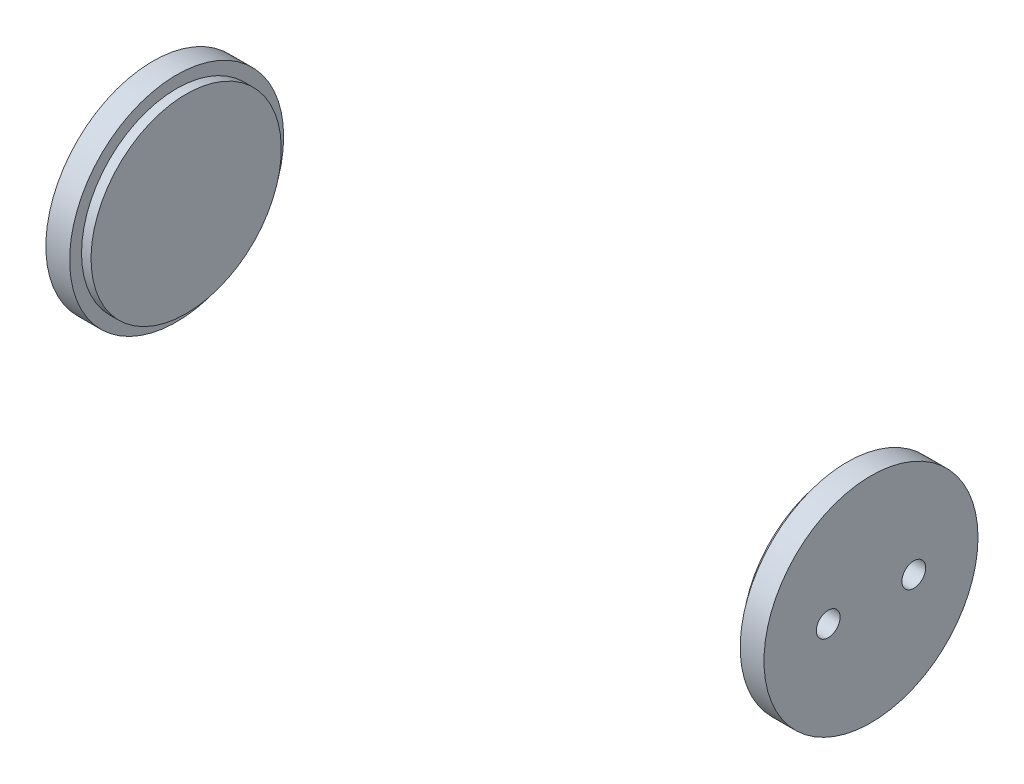
from build123d import *

# Parameters (mm, degrees)
SKETCH1_R           = 22.5
BOSS_EXTRUDE1_DEPTH = 2.5
SKETCH2_R           = 20
BOSS_EXTRUDE2_DEPTH = 2
BOSS_EXTRUDE3_START = 66
SKETCH3_R           = 22.5
BOSS_EXTRUDE3_DEPTH = 66
SKETCH4_R           = 12.5
BOSS_EXTRUDE4_DEPTH = 5
BOSS_EXTRUDE5_START = 66
SKETCH5_R           = 22.5
BOSS_EXTRUDE5_DEPTH = 66
SKETCH6_R           = 20
BOSS_EXTRUDE6_DEPTH = 2
BOSS_EXTRUDE7_START = 5
SKETCH7_R           = 22.5
BOSS_EXTRUDE7_DEPTH = 5
SKETCH8_R           = 2.5
CUT_EXTRUDE1_DEPTH  = 5
CUT_EXTRUDE2_START  = -5
SKETCH9_R           = 2.5
CUT_EXTRUDE2_DEPTH  = 5
SKETCH10_W          = 137
SKETCH10_H          = 45
CUT_EXTRUDE4_DEPTH  = 32


with BuildPart() as part:
    # Sketch1 → Boss-Extrude1 (new, symmetric)
    with BuildSketch(Plane(origin=(0, 0, 0), x_dir=(0, 0, -1), z_dir=(1, 0, 0))):
        Circle(SKETCH1_R)
    extrude(amount=BOSS_EXTRUDE1_DEPTH, both=True)

    # Sketch2 → Boss-Extrude2 (add)
    with BuildSketch(Plane(origin=(2.5, 0, 0), x_dir=(0, 0, -1), z_dir=(1, 0, 0))):
        Circle(SKETCH2_R)
    extrude(amount=BOSS_EXTRUDE2_DEPTH)

    # Sketch3 → Boss-Extrude3 (add)
    with BuildSketch(Plane(origin=(4.5, 0, 0), x_dir=(0, 0, -1), z_dir=(1, 0, 0)).offset(BOSS_EXTRUDE3_START)):
        Circle(SKETCH3_R)
    extrude(amount=-BOSS_EXTRUDE3_DEPTH)

    # Sketch4 → Boss-Extrude4 (add)
    with BuildSketch(Plane(origin=(70.5, 0, 0), x_dir=(0, 0, -1), z_dir=(1, 0, 0))):
        Circle(SKETCH4_R)
    extrude(amount=BOSS_EXTRUDE4_DEPTH)

    # Sketch5 → Boss-Extrude5 (add)
    with BuildSketch(Plane(origin=(75.5, 0, 0), x_dir=(0, 0, -1), z_dir=(1, 0, 0)).offset(BOSS_EXTRUDE5_START)):
        Circle(SKETCH5_R)
    extrude(amount=-BOSS_EXTRUDE5_DEPTH)

    # Sketch6 → Boss-Extrude6 (add)
    with BuildSketch(Plane(origin=(141.5, 0, 0), x_dir=(0, 0, -1), z_dir=(1, 0, 0))):
        Circle(SKETCH6_R)
    extrude(amount=BOSS_EXTRUDE6_DEPTH)

    # Sketch7 → Boss-Extrude7 (add)
    with BuildSketch(Plane(origin=(143.5, 0, 0), x_dir=(0, 0, -1), z_dir=(1, 0, 0)).offset(BOSS_EXTRUDE7_START)):
        Circle(SKETCH7_R)
    extrude(amount=-BOSS_EXTRUDE7_DEPTH)

    # Sketch8 → Cut-Extrude1 (cut)
    with BuildSketch(Plane(origin=(148.5, 0, 0), x_dir=(0, 0, -1), z_dir=(1, 0, 0))):
        with Locations((-9, 0)):
            Circle(SKETCH8_R)
        with Locations((9, 0)):
            Circle(SKETCH8_R)
    extrude(amount=-CUT_EXTRUDE1_DEPTH, mode=Mode.SUBTRACT)

    # Sketch9 → Cut-Extrude2 (cut)
    with BuildSketch(Plane.ZY.offset(2.5).offset(CUT_EXTRUDE2_START)):
        with Locations(Location((-9, 0, 0), (0, 0, 180))):
            Circle(SKETCH9_R)
        with Locations(Location((9, 0, 0), (0, 0, 180))):
            Circle(SKETCH9_R)
    extrude(amount=CUT_EXTRUDE2_DEPTH, mode=Mode.SUBTRACT)

    # Sketch10 → Cut-Extrude4 (cut, symmetric)
    with BuildSketch(Plane.XY):
        with Locations((73, 0)):
            Rectangle(SKETCH10_W, SKETCH10_H)
    extrude(amount=CUT_EXTRUDE4_DEPTH, both=True, mode=Mode.SUBTRACT)


with BuildPart() as cut_extrude4_piece_1:
    # of the separate pieces the step leaves, piece 1, a body of its own (cut_extrude4_pieces)
    add(part.part.solids().sort_by_distance((2.5, 0, -20))[0])


with BuildPart() as cut_extrude4_piece_2:
    # of the separate pieces the step leaves, piece 2, a body of its own (cut_extrude4_pieces)
    add(part.part.solids().sort_by_distance((148.5, 0, -22.5))[0])


solid = Compound([cut_extrude4_piece_1.part, cut_extrude4_piece_2.part])
